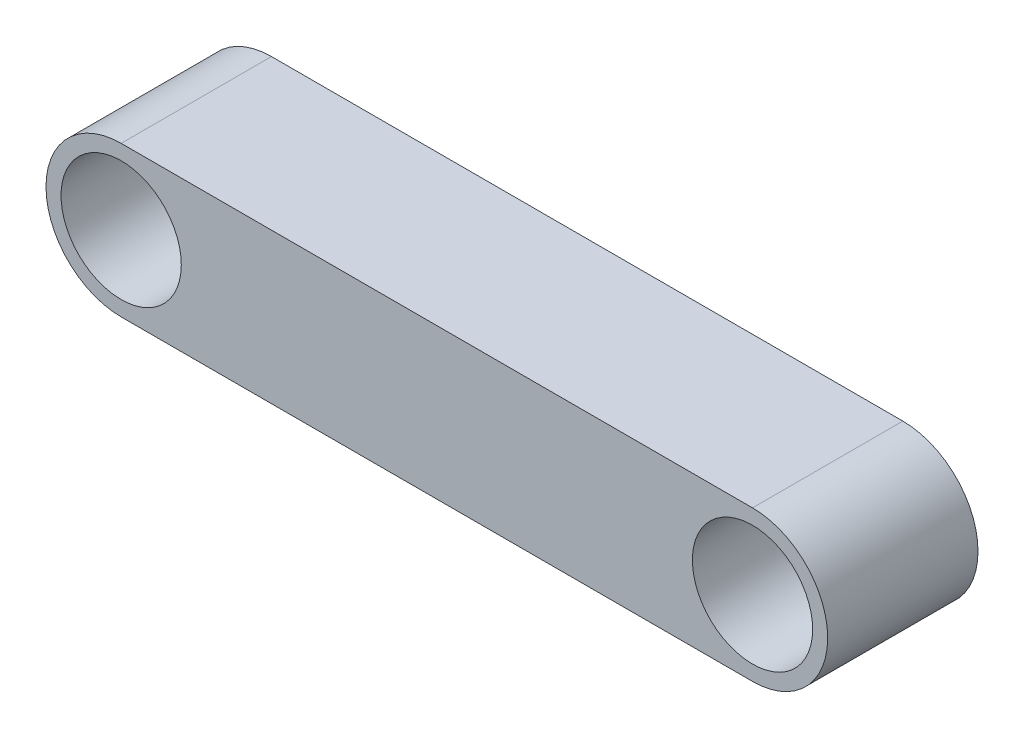
from build123d import *

# Parameters (mm, degrees)
SKETCH1_R           = 4
BOSS_EXTRUDE1_DEPTH = 10


with BuildPart() as part:
    # Sketch1 → Boss-Extrude1 (new body)
    with BuildSketch(Plane.XY):
        with BuildLine():
            Line((0, 5), (42, 5))
            ThreePointArc((42, 5), (47, 0), (42, -5))
            Line((42, -5), (0, -5))
            ThreePointArc((0, -5), (-5, 0), (0, 5))
        make_face()
        Circle(SKETCH1_R, mode=Mode.SUBTRACT)
        with Locations((42, 0)):
            Circle(SKETCH1_R, mode=Mode.SUBTRACT)
    extrude(amount=BOSS_EXTRUDE1_DEPTH)


solid = part.part
